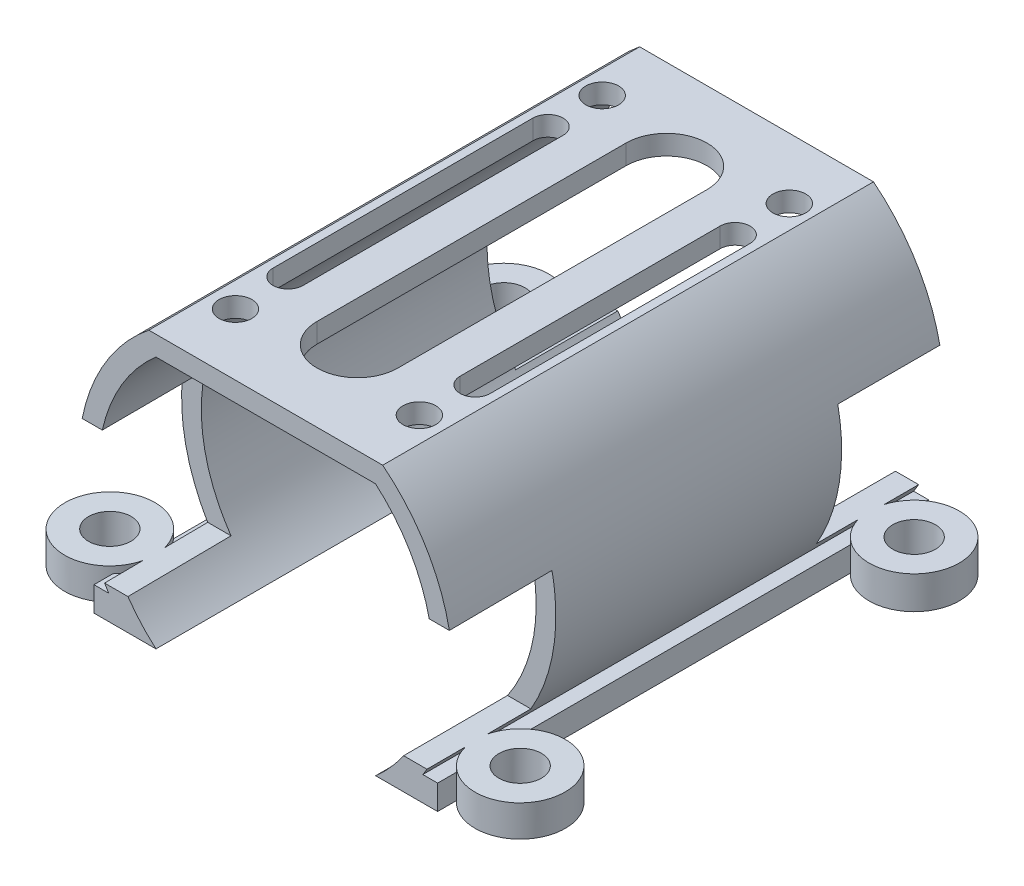
from build123d import *

# Parameters (mm, degrees)
SALIENTE_EXTRUIR1_DEPTH    = 30
VACIADO1_T                 = 1.2
CROQUIS2_W                 = 41.64599518
CROQUIS2_H                 = 31.401201606
CORTAR_EXTRUIR1_DEPTH      = 1.3
CROQUIS3_W                 = 19.002401527
CROQUIS3_H                 = 2.972205444
CORTAR_EXTRUIR2_DEPTH      = 48.3
CROQUIS4_R                 = 2.75
CROQUIS4_R_2               = 1.3
SALIENTE_EXTRUIR2_DEPTH    = 2
SALIENTE_EXTRUIR2_2_DEPTH  = 2
SALIENTE_EXTRUIR2_3_DEPTH  = 2
SALIENTE_EXTRUIR2_4_DEPTH  = 2
CROQUIS5_W                 = 2.061100057
CROQUIS5_H                 = 29.9
SALIENTE_EXTRUIR3_DEPTH    = 1.5
CROQUIS6_R                 = 1
CORTAR_EXTRUIR3_DEPTH      = 7
CORTAR_EXTRUIR4_DEPTH      = 30
CORTAR_EXTRUIR4_DEPTH_BACK = 32
CROQUIS9_W                 = 7.787362377
CROQUIS9_H                 = 8.000416911


with BuildPart() as part:
    # Croquis1 → Saliente-Extruir1 (new body)
    with BuildSketch(Plane.XY):
        with BuildLine():
            Line((-6.68954408, 7.7), (6.68954408, 7.7))
            ThreePointArc((6.68954408, 7.7), (10.2, 0), (6.68954408, -7.7))
            Line((6.68954408, -7.7), (-6.68954408, -7.7))
            ThreePointArc((-6.68954408, -7.7), (-10.2, 0), (-6.68954408, 7.7))
        make_face()
    extrude(amount=SALIENTE_EXTRUIR1_DEPTH)

    # Vaciado1
    vaciado1_openings = [part.faces().sort_by_distance(p)[0] for p in [
        (0, 0, 30),
    ]]
    offset(amount=VACIADO1_T, openings=vaciado1_openings, kind=Kind.INTERSECTION)

    # Croquis2 → Cortar-Extruir1 (cut)
    with BuildSketch(Plane(origin=(0, 0, -1.2), x_dir=(-1, 0, 0), z_dir=(0, 0, -1))):
        Rectangle(CROQUIS2_W, CROQUIS2_H)
    extrude(amount=-CORTAR_EXTRUIR1_DEPTH, mode=Mode.SUBTRACT)

    # Croquis3 → Cortar-Extruir2 (cut)
    with BuildSketch(Plane.XY.offset(30)):
        with Locations((-0.191367802, -9.186102722)):
            Rectangle(CROQUIS3_W, CROQUIS3_H)
    extrude(amount=-CORTAR_EXTRUIR2_DEPTH, mode=Mode.SUBTRACT)



with BuildPart() as body_2:
    # Croquis4 → Saliente-Extruir2 (new body)
    with BuildSketch(Plane.XZ.offset(7.7)):
        with Locations(Location((12.5, 3, 0), (0, 0, 270))):
            Circle(CROQUIS4_R)
        with Locations(Location((12.5, 3, 0), (0, 0, 270))):
            Circle(CROQUIS4_R_2, mode=Mode.SUBTRACT)
    extrude(amount=-SALIENTE_EXTRUIR2_DEPTH)


with BuildPart() as body_3:
    # Croquis4 → Saliente-Extruir2 2 (new body)
    with BuildSketch(Plane.XZ.offset(7.7)):
        with Locations(Location((12.5, 27, 0), (0, 0, 90))):
            Circle(CROQUIS4_R)
        with Locations(Location((12.5, 27, 0), (0, 0, 90))):
            Circle(CROQUIS4_R_2, mode=Mode.SUBTRACT)
    extrude(amount=-SALIENTE_EXTRUIR2_2_DEPTH)


with BuildPart() as body_4:
    # Croquis4 → Saliente-Extruir2 3 (new body)
    with BuildSketch(Plane.XZ.offset(7.7)):
        with Locations(Location((-12.5, 27, 0), (0, 0, 270))):
            Circle(CROQUIS4_R)
        with Locations(Location((-12.5, 27, 0), (0, 0, 270))):
            Circle(CROQUIS4_R_2, mode=Mode.SUBTRACT)
    extrude(amount=-SALIENTE_EXTRUIR2_3_DEPTH)


with BuildPart() as body_5:
    # Croquis4 → Saliente-Extruir2 4 (new body)
    with BuildSketch(Plane.XZ.offset(7.7)):
        with Locations(Location((-12.5, 3, 0), (0, 0, 90))):
            Circle(CROQUIS4_R)
        with Locations(Location((-12.5, 3, 0), (0, 0, 90))):
            Circle(CROQUIS4_R_2, mode=Mode.SUBTRACT)
    extrude(amount=-SALIENTE_EXTRUIR2_4_DEPTH)


with BuildPart() as part_1:
    add(part.part)

    add(body_2.part)  # Saliente-Extruir3 merges body 2

    add(body_3.part)  # Saliente-Extruir3 merges body 3

    add(body_4.part)  # Saliente-Extruir3 merges body 4

    add(body_5.part)  # Saliente-Extruir3 merges body 5
    # Croquis5 → Saliente-Extruir3 (add)
    with BuildSketch(Plane.XZ.offset(7.7)):
        with Locations((-9.437095098, 15.05)):
            Rectangle(CROQUIS5_W, CROQUIS5_H)
        with Locations((9.437095098, 15.05)):
            Rectangle(CROQUIS5_W, CROQUIS5_H)
    extrude(amount=-SALIENTE_EXTRUIR3_DEPTH)

    # Croquis6 → Cortar-Extruir3 (cut)
    with BuildSketch(Plane(origin=(0, 8.9, 0), x_dir=(1, 0, 0), z_dir=(0, 1, 0))):
        with Locations(Location((5.7, -3.804995741, 0), (0, 0, 180))):
            Circle(CROQUIS6_R)
        with Locations((5.601580803, -26.244572596)):
            Circle(CROQUIS6_R)
        with Locations(Location((-5.7, -3.804995741, 0), (0, 0, 188.292737021))):
            Circle(CROQUIS6_R)
        with Locations(Location((-5.601580803, -26.244572596, 0), (0, 0, 180))):
            Circle(CROQUIS6_R)
        with BuildLine():
            Line((-2.462626263, -24.414792503), (-2.462626263, -5.585207497))
            ThreePointArc((-2.462626263, -5.585207497), (0, -3.122581234), (2.462626263, -5.585207497))
            Line((2.462626263, -5.585207497), (2.462626263, -24.414792503))
            ThreePointArc((2.462626263, -24.414792503), (0, -26.877418766), (-2.462626263, -24.414792503))
        make_face()
        with BuildLine():
            Line((6.616453694, -7.107894038), (6.616453694, -22.942105962))
            ThreePointArc((6.616453694, -22.942105962), (5.7, -23.858559655), (4.783546306, -22.942105962))
            Line((4.783546306, -22.942105962), (4.783546306, -7.107894038))
            ThreePointArc((4.783546306, -7.107894038), (5.7, -6.191440345), (6.616453694, -7.107894038))
        make_face()
        with BuildLine():
            Line((-6.616453694, -7.107894038), (-6.616453694, -22.942105962))
            ThreePointArc((-6.616453694, -22.942105962), (-5.7, -23.858559655), (-4.783546306, -22.942105962))
            Line((-4.783546306, -22.942105962), (-4.783546306, -7.107894038))
            ThreePointArc((-4.783546306, -7.107894038), (-5.7, -6.191440345), (-6.616453694, -7.107894038))
        make_face()
    extrude(amount=-CORTAR_EXTRUIR3_DEPTH, mode=Mode.SUBTRACT)

    # Croquis9 → Cortar-Extruir4 (cut, two sides: drawn at the far end of the back side and taken through both)
    with BuildSketch(Plane(origin=(0, 0, 0), x_dir=(0, 0, -1), z_dir=(1, 0, 0)).offset(-CORTAR_EXTRUIR4_DEPTH_BACK)):
        with Locations((-2.424964561, -1.699791545)):
            Rectangle(CROQUIS9_W, CROQUIS9_H)
        Polygon((-31.528660737, 2.20102722), (-23.741439659, 2.247938616), (-23.693244814, -5.75233313), (-31.480465891, -5.799244526), align=None)
    extrude(amount=CORTAR_EXTRUIR4_DEPTH + CORTAR_EXTRUIR4_DEPTH_BACK, mode=Mode.SUBTRACT)


solid = part_1.part
